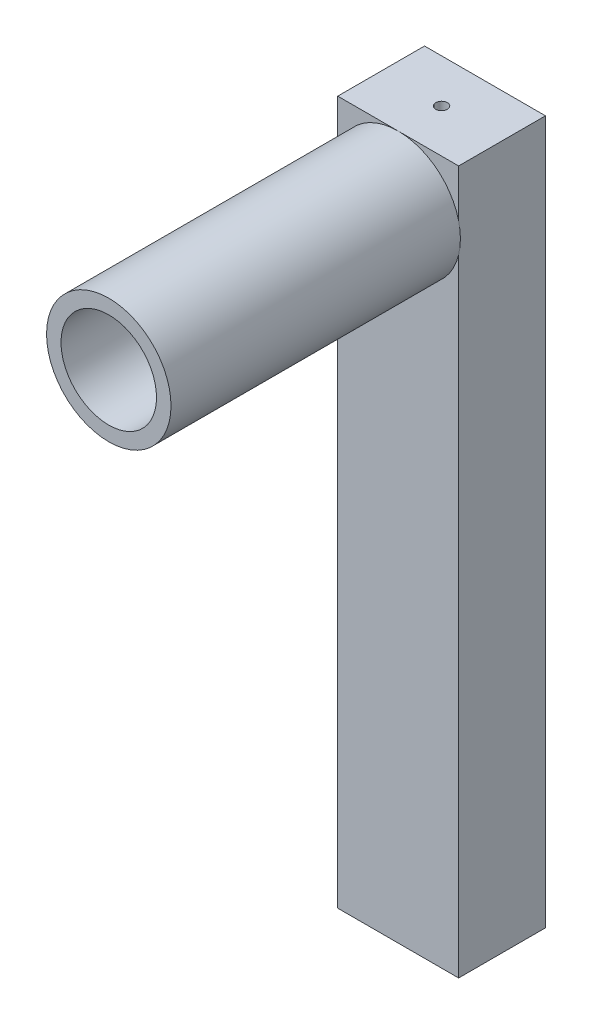
from build123d import *

# Parameters (mm, degrees)
SKETCH_1_R          = 10.75
EXTRUDE_1_DEPTH     = 50
SKETCH_2_W          = 20.887285672
SKETCH_2_H          = 21.5
EXTRUDE_2_DEPTH     = 15
SKETCH_3_W          = 20.887285672
SKETCH_3_H          = 15
EXTRUDE_3_DEPTH     = 100
SKETCH_4_R          = 1
CUT_EXTRUDE_1_DEPTH = 130
SKETCH_5_R          = 8.25
CUT_EXTRUDE_4_DEPTH = 50


with BuildPart() as part:
    # 草图1 → 凸台-拉伸1 (new body)
    with BuildSketch(Plane.XY):
        Circle(SKETCH_1_R)
    extrude(amount=EXTRUDE_1_DEPTH)

    # 草图2 → 凸台-拉伸2 (add)
    with BuildSketch(Plane.XY):
        Rectangle(SKETCH_2_W, SKETCH_2_H)
    extrude(amount=-EXTRUDE_2_DEPTH)

    # 草图3 → 凸台-拉伸3 (add)
    with BuildSketch(Plane.XZ.offset(10.75)):
        with Locations((0, -7.5)):
            Rectangle(SKETCH_3_W, SKETCH_3_H)
    extrude(amount=EXTRUDE_3_DEPTH)

    # 草图4 → 切除-拉伸1 (cut)
    with BuildSketch(Plane(origin=(0, 10.75, 0), x_dir=(1, 0, 0), z_dir=(0, 1, 0))):
        with Locations((0, 7.5)):
            Circle(SKETCH_4_R)
    extrude(amount=-CUT_EXTRUDE_1_DEPTH, mode=Mode.SUBTRACT)

    # 草图5 → 切除-拉伸4 (cut)
    with BuildSketch(Plane.XY.offset(50)):
        Circle(SKETCH_5_R)
    extrude(amount=-CUT_EXTRUDE_4_DEPTH, mode=Mode.SUBTRACT)


solid = part.part
